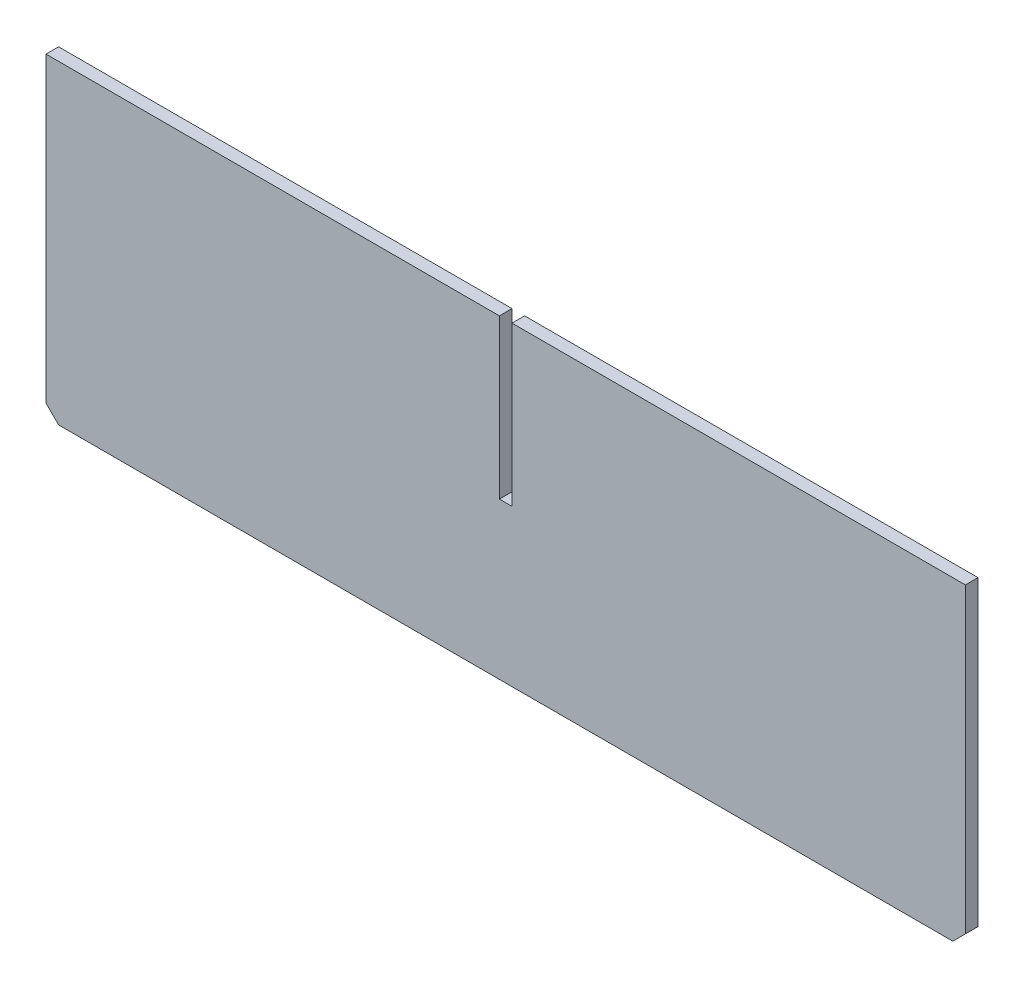
from build123d import *

# Parameters (mm, degrees)
SKETCH_1_W          = 146
SKETCH_1_H          = 50
EXTRUDE_1_DEPTH     = 2
CHAMFER_1_SIZE      = 2
SKETCH_2_W          = 2
SKETCH_2_H          = 25.2
CUT_EXTRUDE_1_DEPTH = 155.337292966


with BuildPart() as part:
    # 草图1 → 凸台-拉伸1 (new body)
    with BuildSketch(Plane.XY):
        with Locations((73, -25)):
            Rectangle(SKETCH_1_W, SKETCH_1_H)
    extrude(amount=EXTRUDE_1_DEPTH)

    # 倒角1
    chamfer_1_edges = [part.edges().sort_by_distance(p)[0] for p in [
        (146, -50, 1),
        (0, -50, 1),
    ]]
    chamfer(chamfer_1_edges, length=CHAMFER_1_SIZE)

    # 草图2 → 切除-拉伸1 (cut, through all)
    with BuildSketch(Plane.XY.offset(2)):
        with Locations((73, -12.6)):
            Rectangle(SKETCH_2_W, SKETCH_2_H)
    extrude(amount=-CUT_EXTRUDE_1_DEPTH, mode=Mode.SUBTRACT)


solid = part.part
